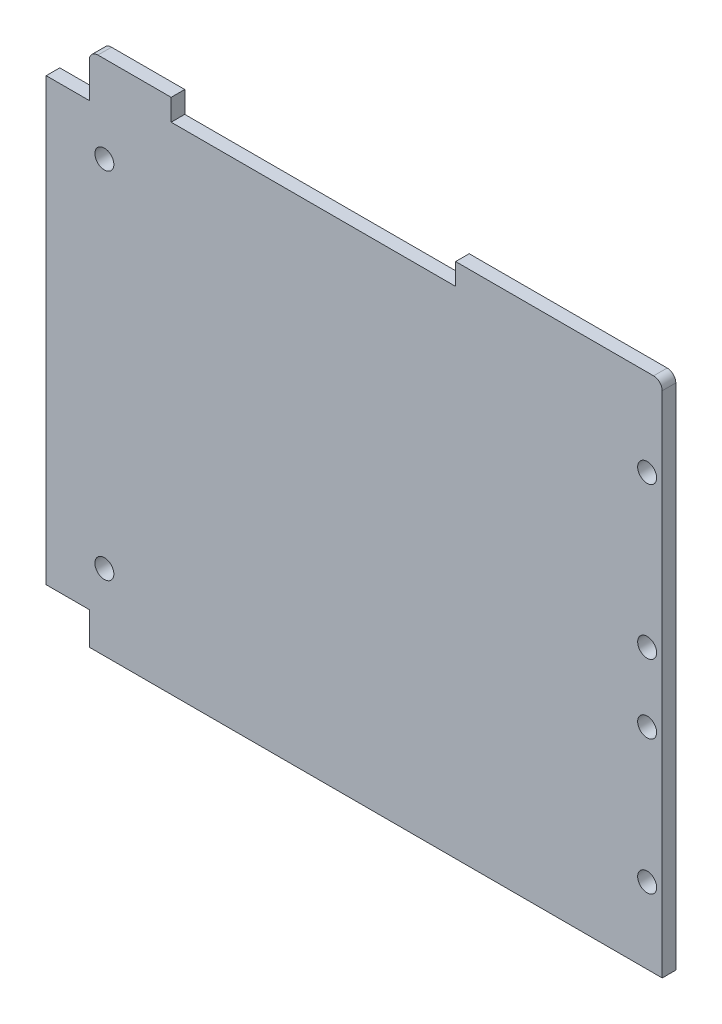
from build123d import *

# Parameters (mm, degrees)
BOSS_EXTRUDE1_DEPTH  = 1.5748
SKETCH3_W            = 66.47
SKETCH3_H            = 5.335951997
BOSS_EXTRUDE2_DEPTH  = 1.575
SKETCH4_W            = 66.47
SKETCH4_H            = 0.5
CUT_EXTRUDE1_DEPTH   = 134.633133513
M2_CLEARANCE_HOLE1_D = 2.2
SKETCH5_W            = 5
SKETCH5_H            = 51.15
BOSS_EXTRUDE3_DEPTH  = 1.575
SKETCH6_W            = 33
SKETCH6_H            = 2.5
CUT_EXTRUDE2_DEPTH   = 134.633133513


with BuildPart() as part:
    # BPR2 PCB Outline → Boss-Extrude1 (new body)
    with BuildSketch(Plane.XY):
        with BuildLine():
            Line((114.542984325, 6.620432961), (102.642984325, 6.620432961))
            Line((102.642984325, 6.620432961), (82.642984325, 6.620432961))
            Line((82.642984325, 6.620432961), (49.072984325, 6.620432961))
            Line((49.072984325, 6.620432961), (49.072984325, 66.120432961))
            ThreePointArc((49.072984325, 66.120432961), (49.365877543, 66.827539743), (50.072984325, 67.120432961))
            Line((50.072984325, 67.120432961), (114.542984325, 67.120432961))
            ThreePointArc((114.542984325, 67.120432961), (115.250091106, 66.827539743), (115.542984325, 66.120432961))
            Line((115.542984325, 66.120432961), (115.542984325, 7.620432961))
            ThreePointArc((115.542984325, 7.620432961), (115.250091106, 6.91332618), (114.542984325, 6.620432961))
        make_face()
    extrude(amount=-BOSS_EXTRUDE1_DEPTH)

    # Sketch3 → Boss-Extrude2 (add)
    with BuildSketch(Plane.XY):
        with Locations((82.307984325, 9.288408959)):
            Rectangle(SKETCH3_W, SKETCH3_H)
    extrude(amount=-BOSS_EXTRUDE2_DEPTH)

    # Sketch4 → Cut-Extrude1 (cut, through all)
    with BuildSketch(Plane.XY):
        with Locations((82.307984325, 6.870432961)):
            Rectangle(SKETCH4_W, SKETCH4_H)
    extrude(amount=-CUT_EXTRUDE1_DEPTH, mode=Mode.SUBTRACT)

    # M2 Clearance Hole1 (through all)
    with Locations(Plane(origin=(32.762906477, 104.007481373, -6.5748), x_dir=(1, 0, 0), z_dir=(0, 0, -1))):
        with Locations((18.060077848, 88.112048412), (18.060077848, 46.962048412), (81.030077848, 46.962048412), (81.030077848, 64.537048412), (81.030077848, 88.112048412), (81.030077848, 72.537048412)):
            Hole(M2_CLEARANCE_HOLE1_D / 2)

    # Sketch5 → Boss-Extrude3 (add)
    with BuildSketch(Plane.XY):
        with Locations((46.572984325, 36.470432961)):
            Rectangle(SKETCH5_W, SKETCH5_H)
    extrude(amount=-BOSS_EXTRUDE3_DEPTH)

    # Sketch6 → Cut-Extrude2 (cut, through all)
    with BuildSketch(Plane.XY):
        with Locations((75.072984325, 65.870432961)):
            Rectangle(SKETCH6_W, SKETCH6_H)
    extrude(amount=-CUT_EXTRUDE2_DEPTH, mode=Mode.SUBTRACT)


solid = part.part
